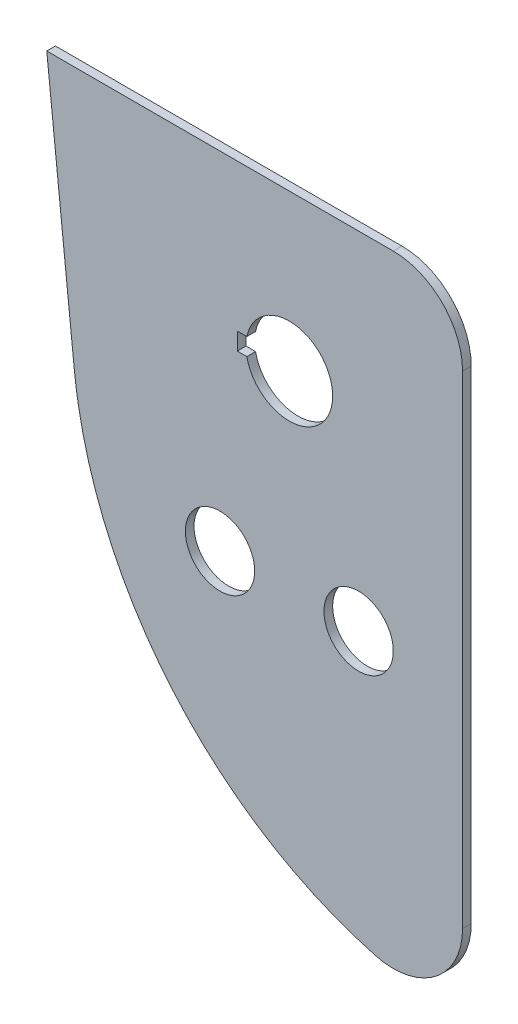
from build123d import *

# Parameters (mm, degrees)
BOSS_EXTRUDE1_DEPTH = 1.5875
SKETCH2_R           = 6.35
CUT_EXTRUDE1_DEPTH  = 200.716179568
FILLET1_R           = 12.7


with BuildPart() as part:
    # Sketch1 → Boss-Extrude1 (new body)
    with BuildSketch(Plane.XY):
        with BuildLine():
            Line((-124.506849283, -39.770231507), (-119.474980228, -87.671358692))
            add(Edge.make_bspline(
                [(-56.3280252, -154.902468877), (-56.346476044, -154.899600353), (-56.402884517, -154.890830617), (-56.611080033, -154.858170111), (-57.104136424, -154.77889222), (-58.050896577, -154.617474356), (-60.354414853, -154.185740423), (-63.388938266, -153.485638357), (-67.010951192, -152.444549796), (-70.219086063, -151.362943176), (-73.446369967, -150.103845866), (-76.612996137, -148.694555998), (-79.712216879, -147.138105291), (-82.737433419, -145.437839357), (-85.682209143, -143.597409415), (-88.540283438, -141.620764011), (-91.305584556, -139.512139868), (-93.972242223, -137.276052336), (-96.534599628, -134.917285272), (-98.987224972, -132.440880464), (-101.324922461, -129.852126585), (-103.542742806, -127.156547725), (-105.635993175, -124.359891507), (-107.600246622, -121.468116813), (-109.431350973, -118.487381131), (-111.125437151, -115.424027557), (-112.678926942, -112.284571448), (-114.088540191, -109.075686767), (-115.351301396, -105.804192123), (-116.464545718, -102.477036535), (-117.425924357, -99.101284939), (-118.233409317, -95.684103469), (-118.885297518, -92.232744524), (-119.242744402, -89.7206526), (-119.408317309, -88.286030012), (-119.442476963, -87.975658316), (-119.45920335, -87.820433155), (-119.468609128, -87.731931499), (-119.473836089, -87.682236519), (-119.474980228, -87.671358692)],
                knots=[0, 0, 0, 0, 0.000570634, 0.001744558, 0.006440232, 0.015831442, 0.031091736, 0.078042667, 0.110904268, 0.146108785, 0.181308268, 0.216502219, 0.251690199, 0.286871835, 0.322046819, 0.357214911, 0.392375937, 0.427529794, 0.462676442, 0.497815906, 0.532948271, 0.568073682, 0.603192339, 0.638304491, 0.673410436, 0.708510515, 0.743605108, 0.77869463, 0.813779526, 0.84886027, 0.88393736, 0.919011312, 0.954082662, 0.989151956, 0.994996677, 0.997334555, 0.998503491, 0.999672426, 1, 1, 1, 1], degree=3))
            Line((-56.3280252, -154.902468877), (-48.306849283, -156.147611733))
            Line((-48.306849283, -156.147611733), (-48.306849283, -39.770231507))
            Line((-48.306849283, -39.770231507), (-124.506849283, -39.770231507))
        make_face()
    extrude(amount=BOSS_EXTRUDE1_DEPTH)

    # Sketch2 → Cut-Extrude1 (cut, through all)
    with BuildSketch(Plane(origin=(0, 0, 0), x_dir=(-1, 0, 0), z_dir=(0, 0, -1))):
        with Locations((67.356849283, -103.270231507)):
            Circle(SKETCH2_R)
        with Locations((92.756849283, -103.270231507)):
            Circle(SKETCH2_R)
        with BuildLine():
            ThreePointArc((87.994349283, -68.345231507), (87.954154998, -67.547441621), (87.833979216, -66.757731507))
            Line((87.833979216, -66.757731507), (86.406849283, -66.757731507))
            Line((86.406849283, -66.757731507), (86.406849283, -69.932731507))
            Line((86.406849283, -69.932731507), (87.833979216, -69.932731507))
            ThreePointArc((87.833979216, -69.932731507), (87.954154998, -69.143021393), (87.994349283, -68.345231507))
        make_face()
        with BuildLine():
            Line((86.406849283, -66.757731507), (87.833979216, -66.757731507))
            ThreePointArc((87.833979216, -66.757731507), (72.119349283, -68.345231507), (87.833979216, -69.932731507))
            Line((87.833979216, -69.932731507), (86.406849283, -69.932731507))
            Line((86.406849283, -69.932731507), (86.406849283, -66.757731507))
        make_face()
        with BuildLine():
            Line((89.581849283, -69.932731507), (89.581849283, -66.757731507))
            Line((89.581849283, -66.757731507), (87.833979216, -66.757731507))
            ThreePointArc((87.833979216, -66.757731507), (87.954154998, -67.547441621), (87.994349283, -68.345231507))
            ThreePointArc((87.994349283, -68.345231507), (87.954154998, -69.143021393), (87.833979216, -69.932731507))
            Line((87.833979216, -69.932731507), (89.581849283, -69.932731507))
        make_face()
    extrude(amount=-CUT_EXTRUDE1_DEPTH, mode=Mode.SUBTRACT)

    # Fillet1
    fillet1_edges = [part.edges().sort_by_distance(p)[0] for p in [
        (-48.306849283, -39.770231507, 0.79375),
        (-48.306849283, -156.147611733, 0.79375),
    ]]
    fillet(fillet1_edges, radius=FILLET1_R)


solid = part.part
